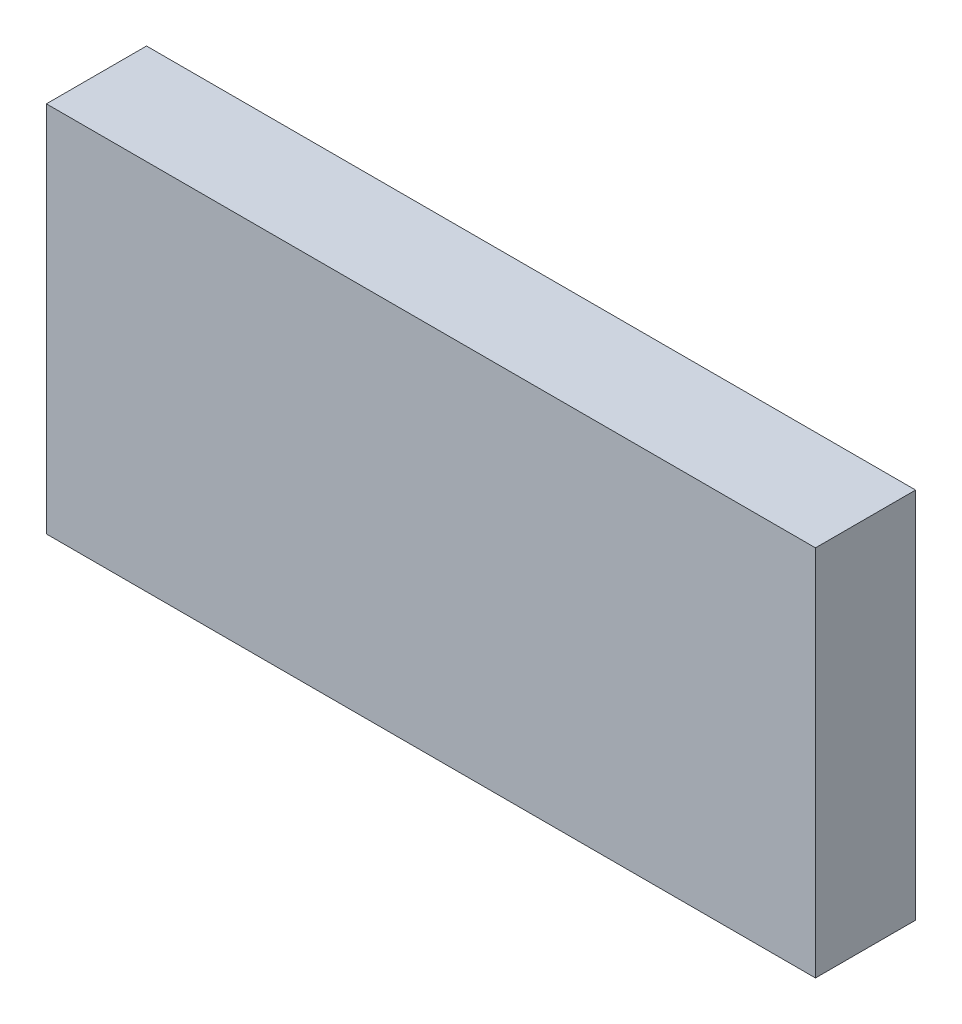
from build123d import *

# Parameters (mm, degrees)
SKETCH1_W           = 48.768
SKETCH1_H           = 23.622
BOSS_EXTRUDE1_DEPTH = 6.35


with BuildPart() as part:
    # Sketch1 → Boss-Extrude1 (new body)
    with BuildSketch(Plane.XY):
        with Locations((-3.790789916, 7.86012605)):
            Rectangle(SKETCH1_W, SKETCH1_H)
    extrude(amount=BOSS_EXTRUDE1_DEPTH)


solid = part.part
